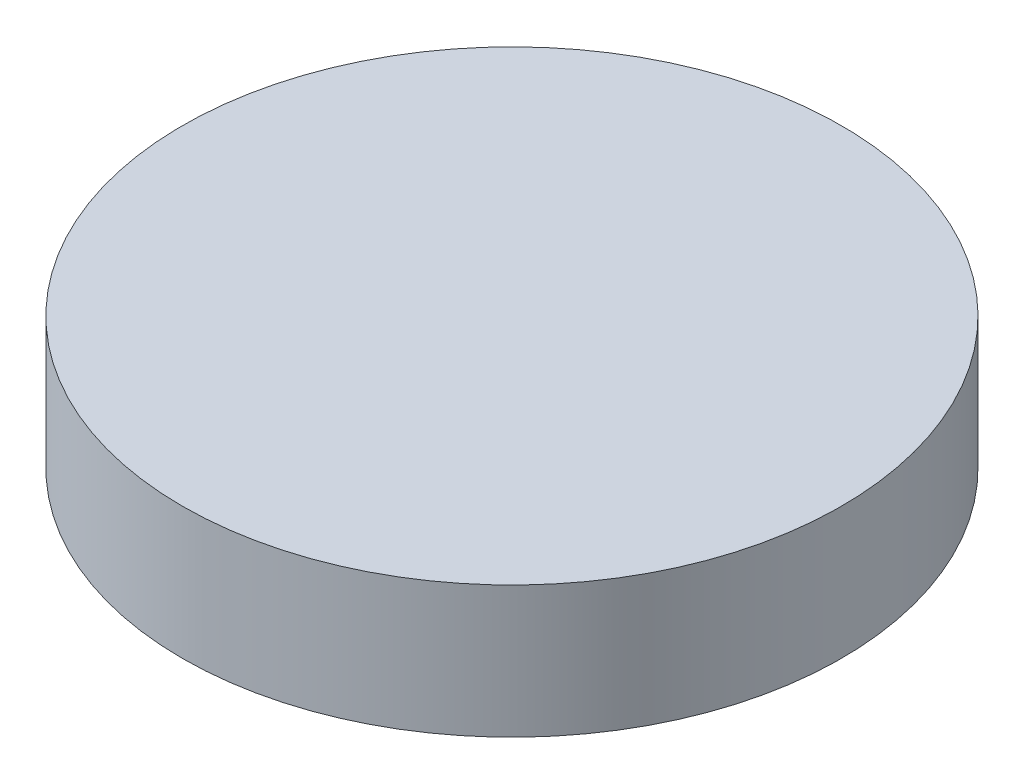
from build123d import *

# Parameters (mm, degrees)
SKETCH2_R           = 3.175
BOSS_EXTRUDE1_DEPTH = 1.27


with BuildPart() as part:
    # Sketch2 → Boss-Extrude1 (new body)
    with BuildSketch(Plane(origin=(0, 0, 0), x_dir=(1, 0, 0), z_dir=(0, 1, 0))):
        with Locations(Location((0, 0, 0), (0, 0, 270))):
            Circle(SKETCH2_R)
    extrude(amount=BOSS_EXTRUDE1_DEPTH)


solid = part.part
